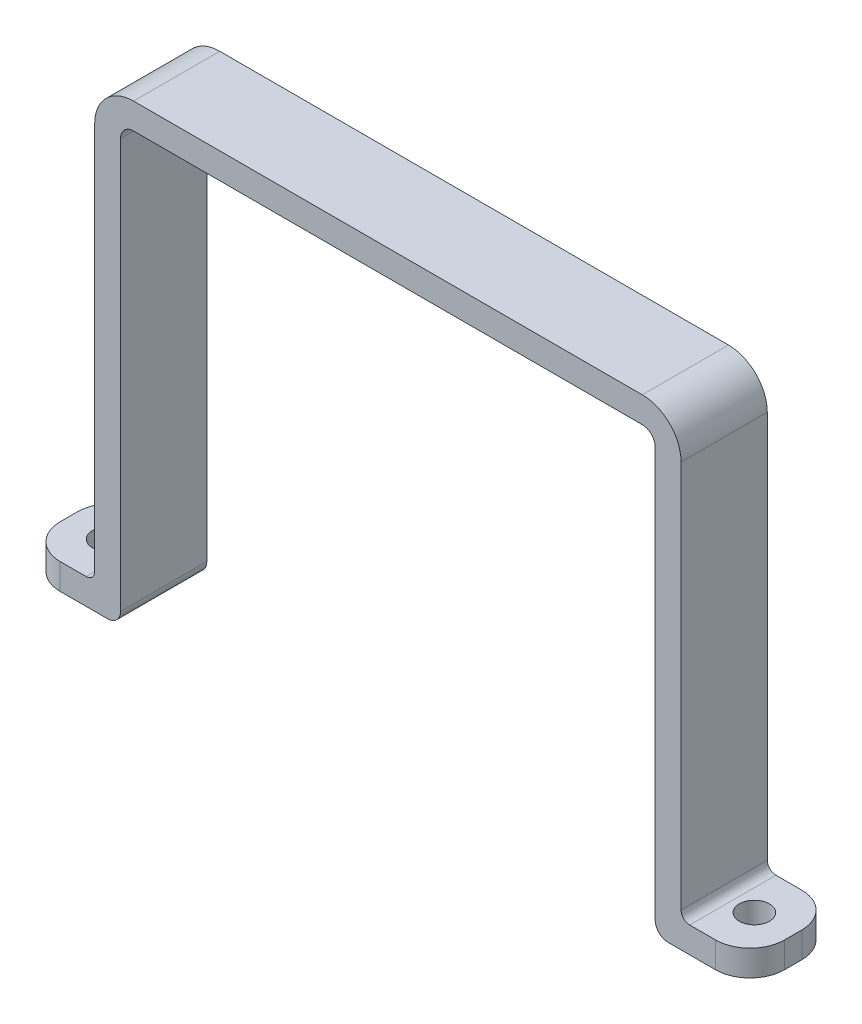
from build123d import *

# Parameters (mm, degrees)
SALIENTE_EXTRUIR1_DEPTH = 5
REDONDEO1_R             = 4
CROQUIS2_R              = 1.75
CORTAR_EXTRUIR1_DEPTH   = 99.138932132
REDONDEO2_R             = 1.5
REDONDEO3_R             = 4.5
REDONDEO4_R             = 1.5
REDONDEO5_R             = 1


with BuildPart() as part:
    # Croquis1 → Saliente-Extruir1 (new, symmetric)
    with BuildSketch(Plane.XY):
        Polygon((0, 0), (11, 0), (11, 50.5), (73, 50.5), (73, 0), (84, 0), (84, 3), (76, 3), (76, 53.5), (8, 53.5), (8, 3), (0, 3), align=None)
    extrude(amount=SALIENTE_EXTRUIR1_DEPTH, both=True)

    # Redondeo1
    redondeo1_edges = [part.edges().sort_by_distance(p)[0] for p in [
        (84, 1.5, -5),
        (0, 1.5, -5),
        (84, 1.5, 5),
        (0, 1.5, 5),
    ]]
    fillet(redondeo1_edges, radius=REDONDEO1_R)

    # Croquis2 → Cortar-Extruir1 (cut, through all)
    with BuildSketch(Plane(origin=(0, 3, 0), x_dir=(1, 0, 0), z_dir=(0, 1, 0))):
        with Locations(Location((79.5, 0, 0), (0, 0, 180))):
            Circle(CROQUIS2_R)
    cortar_extruir1 = extrude(amount=-CORTAR_EXTRUIR1_DEPTH, mode=Mode.SUBTRACT)

    # Simetría1: Cortar-Extruir1 across plane
    add(cortar_extruir1.mirror(Plane(origin=(42, 0, 0), x_dir=(0, 0, 1), z_dir=(1, 0, 0))), mode=Mode.SUBTRACT)

    # Redondeo2
    redondeo2_edges = [part.edges().sort_by_distance(p)[0] for p in [
        (73, 50.5, 0),
        (11, 50.5, 0),
    ]]
    fillet(redondeo2_edges, radius=REDONDEO2_R)

    # Redondeo3
    redondeo3_edges = [part.edges().sort_by_distance(p)[0] for p in [
        (8, 53.5, 0),
        (76, 53.5, 0),
    ]]
    fillet(redondeo3_edges, radius=REDONDEO3_R)

    # Redondeo4
    redondeo4_edges = [part.edges().sort_by_distance(p)[0] for p in [
        (73, 0, 0),
        (11, 0, 0),
    ]]
    fillet(redondeo4_edges, radius=REDONDEO4_R)

    # Redondeo5
    redondeo5_edges = [part.edges().sort_by_distance(p)[0] for p in [
        (8, 3, 0),
        (76, 3, 0),
    ]]
    fillet(redondeo5_edges, radius=REDONDEO5_R)


solid = part.part
